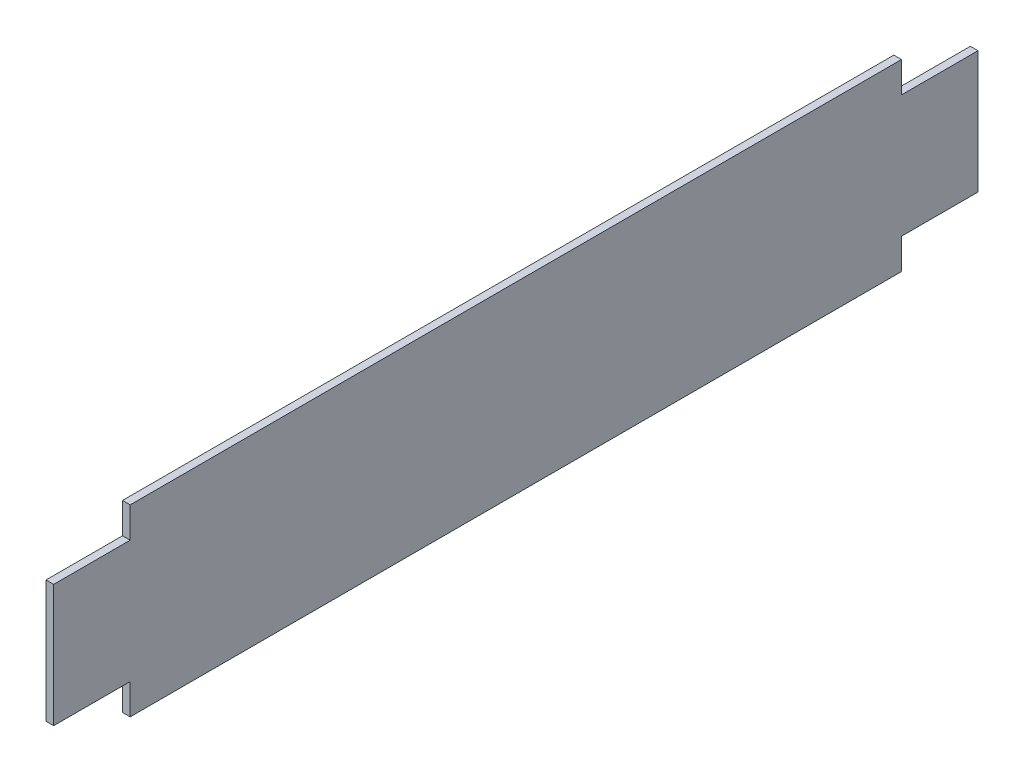
from build123d import *

# Parameters (mm, degrees)
SKETCH1_W           = 3.175
SKETCH1_H           = 50.8
BOSS_EXTRUDE1_DEPTH = 191.77
SKETCH1_3_W         = 3.175
SKETCH1_3_H         = 12.7
BOSS_EXTRUDE2_DEPTH = 160.02


with BuildPart() as part:
    # Sketch1 → Boss-Extrude1 (new, symmetric)
    with BuildSketch(Plane.XY):
        Rectangle(SKETCH1_W, SKETCH1_H)
    extrude(amount=BOSS_EXTRUDE1_DEPTH, both=True)

    # Sketch1<3> → Boss-Extrude2 (add, symmetric)
    with BuildSketch(Plane.XY):
        with Locations((0, 31.75)):
            Rectangle(SKETCH1_3_W, SKETCH1_3_H)
        with Locations((0, -31.75)):
            Rectangle(SKETCH1_3_W, SKETCH1_3_H)
    extrude(amount=BOSS_EXTRUDE2_DEPTH, both=True)


solid = part.part
